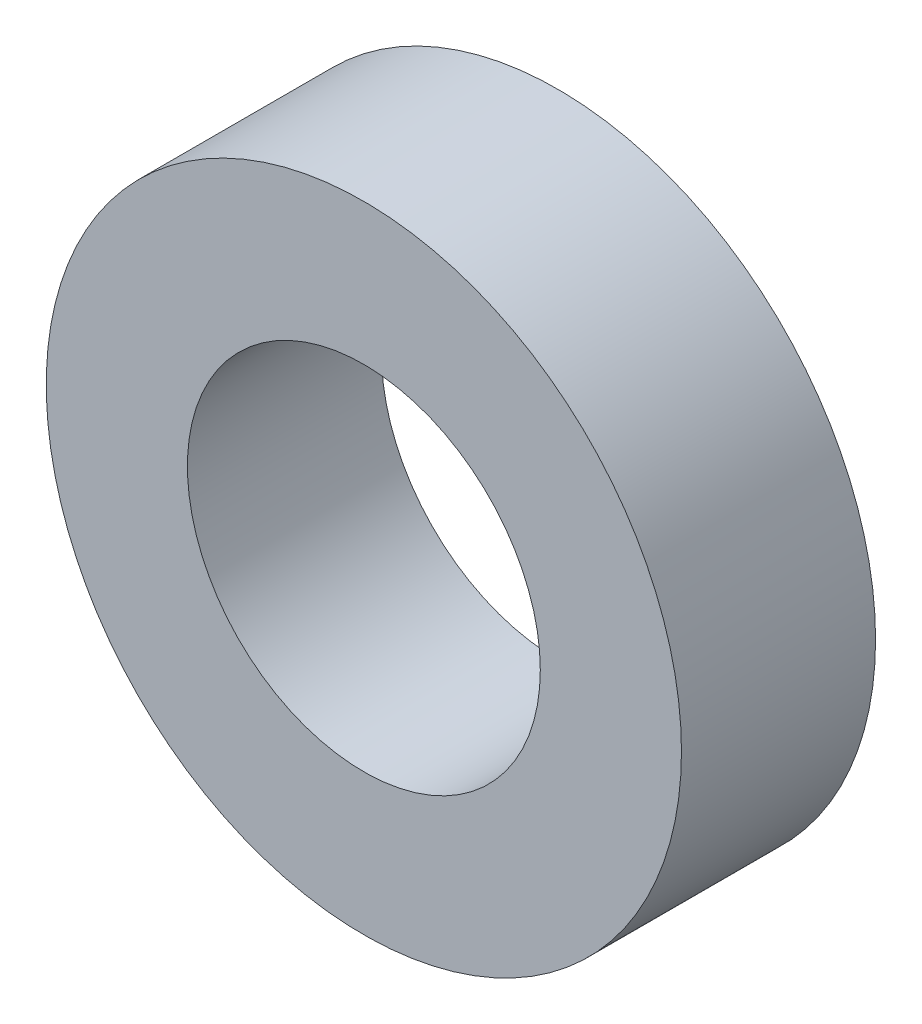
from build123d import *

# Parameters (mm, degrees)
SKETCH_1_R      = 9
SKETCH_1_R_2    = 5
EXTRUDE_1_DEPTH = 2.75


with BuildPart() as part:
    # 草图1 → 凸台-拉伸1 (new, symmetric)
    with BuildSketch(Plane.XY):
        Circle(SKETCH_1_R)
        Circle(SKETCH_1_R_2, mode=Mode.SUBTRACT)
    extrude(amount=EXTRUDE_1_DEPTH, both=True)


solid = part.part
